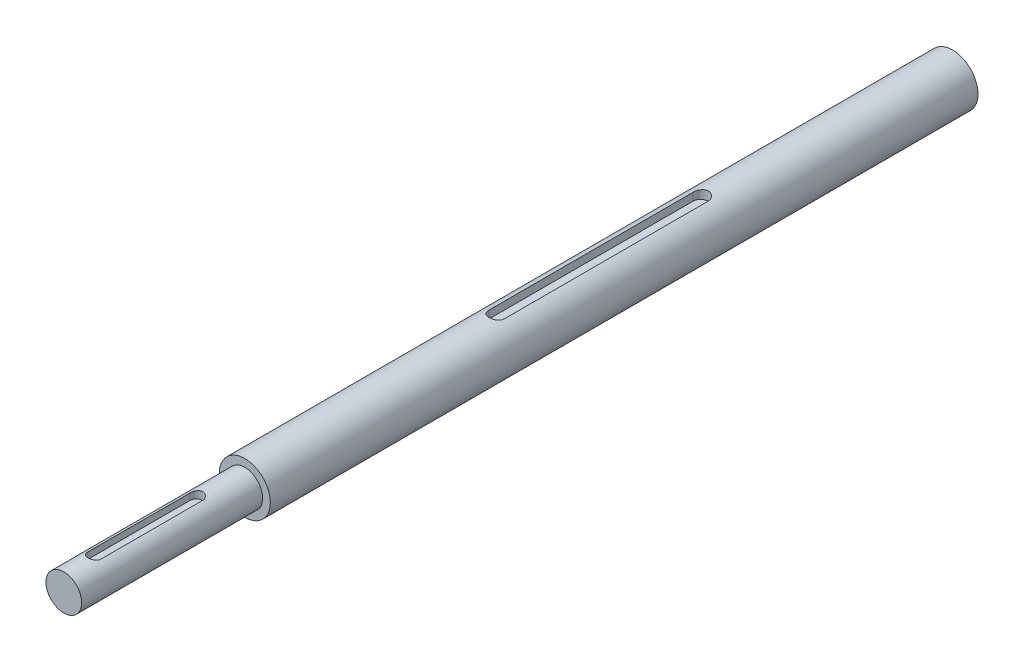
from build123d import *

# Parameters (mm, degrees)
SKETCH1_R           = 10
BOSS_EXTRUDE1_DEPTH = 138.8
SKETCH2_R           = 7
BOSS_EXTRUDE2_DEPTH = 71
CUT_EXTRUDE1_DEPTH  = 3
CUT_EXTRUDE2_DEPTH  = 3.5


with BuildPart() as part:
    # Sketch1 → Boss-Extrude1 (new, symmetric)
    with BuildSketch(Plane.XY):
        Circle(SKETCH1_R)
    extrude(amount=BOSS_EXTRUDE1_DEPTH, both=True)

    # Sketch2 → Boss-Extrude2 (add)
    with BuildSketch(Plane.XY.offset(138.8)):
        Circle(SKETCH2_R)
    extrude(amount=BOSS_EXTRUDE2_DEPTH)

    # Sketch4 → Cut-Extrude1 (cut)
    with BuildSketch(Plane(origin=(0, 7, 0), x_dir=(1, 0, 0), z_dir=(0, 1, 0))):
        with BuildLine():
            Line((-2.5, -197.8), (-2.5, -157.8))
            ThreePointArc((-2.5, -157.8), (0, -155.3), (2.5, -157.8))
            Line((2.5, -157.8), (2.5, -197.8))
            ThreePointArc((2.5, -197.8), (0, -200.3), (-2.5, -197.8))
        make_face()
    extrude(amount=-CUT_EXTRUDE1_DEPTH, mode=Mode.SUBTRACT)

    # Sketch5 → Cut-Extrude2 (cut)
    with BuildSketch(Plane(origin=(0, 10, 0), x_dir=(1, 0, 0), z_dir=(0, 1, 0))):
        with BuildLine():
            Line((-3, -40), (-3, 40))
            ThreePointArc((-3, 40), (0, 43), (3, 40))
            Line((3, 40), (3, -40))
            ThreePointArc((3, -40), (0, -43), (-3, -40))
        make_face()
    extrude(amount=-CUT_EXTRUDE2_DEPTH, mode=Mode.SUBTRACT)


solid = part.part
